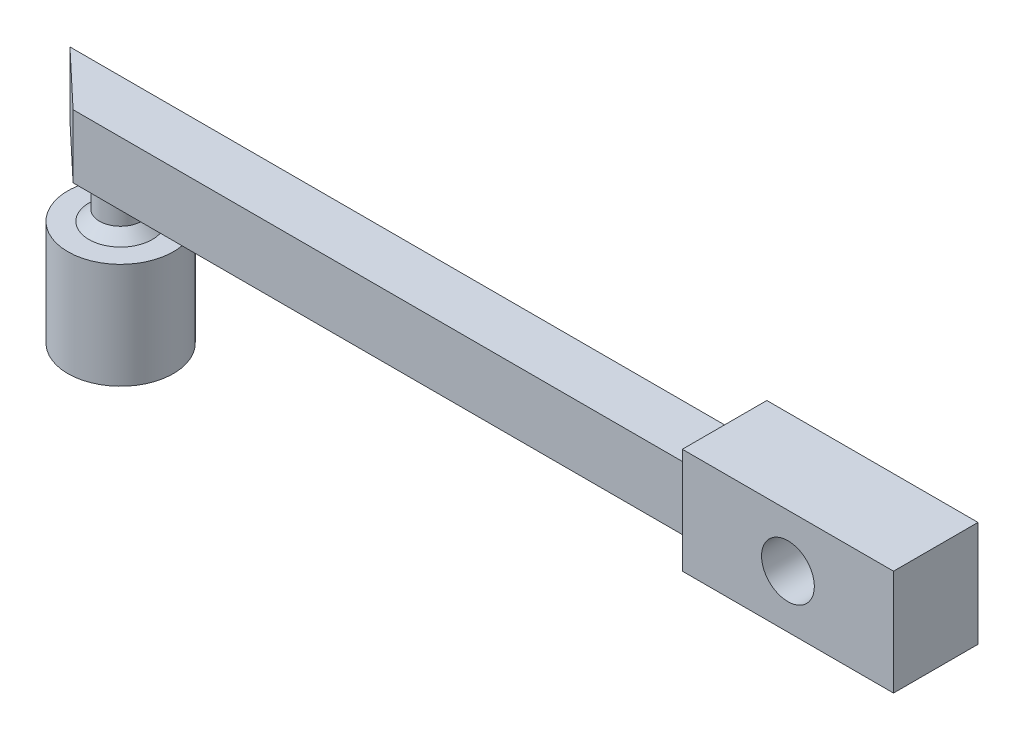
from build123d import *

# Parameters (mm, degrees)
SCHIZZO1_W                   = 33
SCHIZZO1_H                   = 3
ESTRUSIONE_ESTRUSIONE1_DEPTH = 2.5
TAGLIO_ESTRUSIONE1_DEPTH     = 17.955824958
SCHIZZO3_R                   = 1
ESTRUSIONE_ESTRUSIONE2_DEPTH = 1.7
SCHIZZO5_R                   = 2.5
ESTRUSIONE_ESTRUSIONE3_DEPTH = 5
SMUSSO2_SIZE                 = 0.5
SCHIZZO8_W                   = 4
SCHIZZO8_H                   = 5
ESTRUSIONE_ESTRUSIONE6_DEPTH = 10
TAGLIO_ESTRUSIONE3_DEPTH     = 29.232118234
TAGLIO_ESTRUSIONE4_START     = -5
TAGLIO_ESTRUSIONE4_DEPTH     = 5


with BuildPart() as part:
    # Schizzo1 → Estrusione-Estrusione1 (new body)
    with BuildSketch(Plane.XY):
        Rectangle(SCHIZZO1_W, SCHIZZO1_H)
    extrude(amount=ESTRUSIONE_ESTRUSIONE1_DEPTH)

    # Schizzo2 → Taglio-Estrusione1 (cut, through all)
    with BuildSketch(Plane.XZ.offset(1.5)):
        Polygon((-16.5, 0), (-13.85, 2.5), (-16.5, 2.5), align=None)
    extrude(amount=-TAGLIO_ESTRUSIONE1_DEPTH, mode=Mode.SUBTRACT)

    # Schizzo3 → Estrusione-Estrusione2 (add)
    with BuildSketch(Plane.XZ.offset(1.5)):
        with Locations(Location((-12.85, 1.25, 0), (0, 0, 180))):
            Circle(SCHIZZO3_R)
    extrude(amount=ESTRUSIONE_ESTRUSIONE2_DEPTH)

    # Schizzo5 → Estrusione-Estrusione3 (add)
    with BuildSketch(Plane.XZ.offset(3.2)):
        with Locations((-12.85, 1.25)):
            Circle(SCHIZZO5_R)
    extrude(amount=ESTRUSIONE_ESTRUSIONE3_DEPTH)

    # Smusso2
    smusso2_edges = [part.edges().sort_by_distance(p)[0] for p in [
        (-11.85, -3.2, 1.25),
    ]]
    chamfer(smusso2_edges, length=SMUSSO2_SIZE)

    # Schizzo8 → Estrusione-Estrusione6 (add)
    with BuildSketch(Plane(origin=(16.5, 0, 0), x_dir=(0, 0, -1), z_dir=(1, 0, 0))):
        with Locations((-2, 1)):
            Rectangle(SCHIZZO8_W, SCHIZZO8_H)
    extrude(amount=ESTRUSIONE_ESTRUSIONE6_DEPTH)

    # Schizzo9 → Taglio-Estrusione3 (cut, through all)
    with BuildSketch(Plane.XY.offset(4)):
        with BuildLine():
            ThreePointArc((22.75, 1), (21.787191151, 2.216561237), (20.381966011, 1.559016994))
            Line((20.381966011, 1.559016994), (22.618033989, 0.440983006))
            ThreePointArc((22.618033989, 0.440983006), (22.716561237, 0.712808849), (22.75, 1))
        make_face()
        with BuildLine():
            Line((22.618033989, 0.440983006), (20.381966011, 1.559016994))
            ThreePointArc((20.381966011, 1.559016994), (20.940983006, -0.118033989), (22.618033989, 0.440983006))
        make_face()
    extrude(amount=-TAGLIO_ESTRUSIONE3_DEPTH, mode=Mode.SUBTRACT)

    # Schizzo10 → Taglio-Estrusione4 (cut)
    with BuildSketch(Plane.XZ.offset(8.2).offset(TAGLIO_ESTRUSIONE4_START)):
        with BuildLine():
            Line((-11.35, -0.75), (-14.35, -0.75))
            ThreePointArc((-14.35, -0.75), (-12.85, -1.25), (-11.35, -0.75))
        make_face()
    extrude(amount=TAGLIO_ESTRUSIONE4_DEPTH, mode=Mode.SUBTRACT)


solid = part.part
